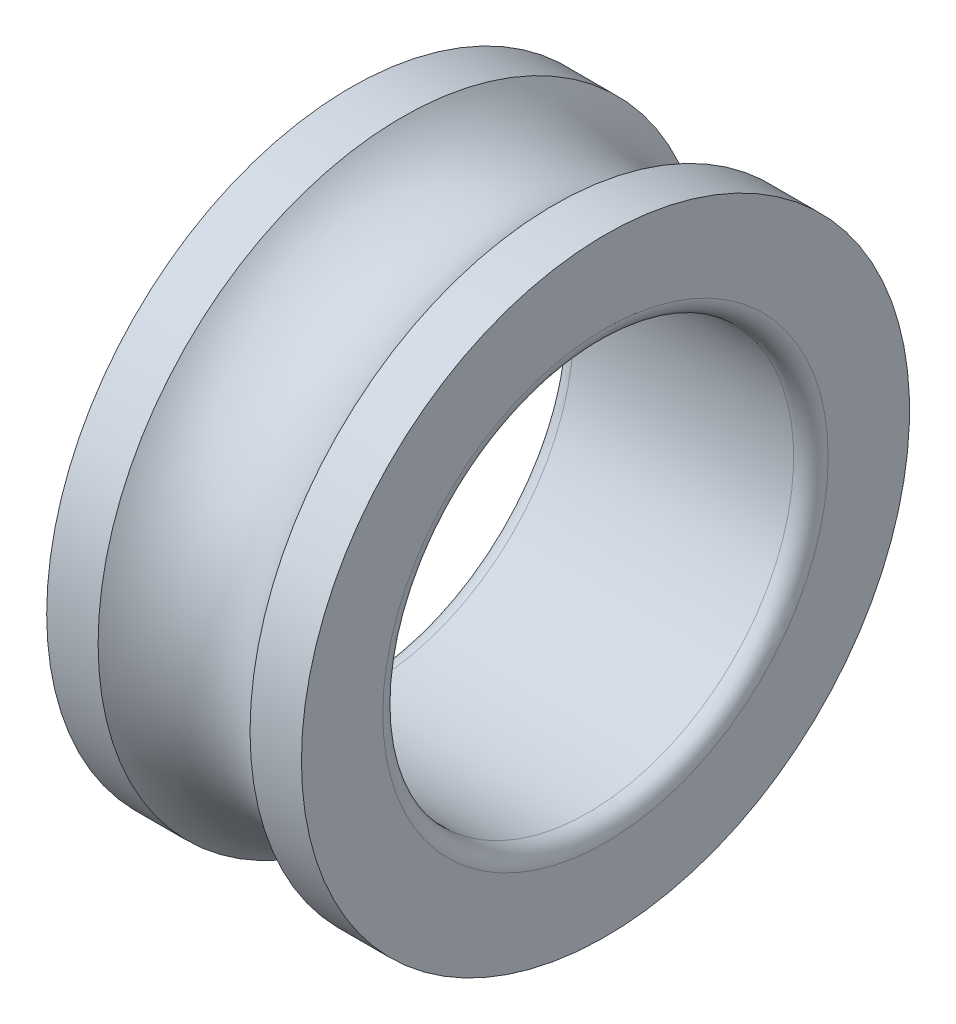
from build123d import *


with BuildPart() as part:
    # Sketch2 → Revolve1 (revolve)
    with BuildSketch(Plane.XY, mode=Mode.PRIVATE) as revolve1_sk:
        with BuildLine():
            Line((9.24426332, 37), (15.5, 37))
            Line((15.5, 37), (15.5, 27.1))
            ThreePointArc((15.5, 27.1), (14.88492424, 25.61507576), (13.4, 25))
            Line((13.4, 25), (-13.4, 25))
            ThreePointArc((-13.4, 25), (-14.88492424, 25.61507576), (-15.5, 27.1))
            Line((-15.5, 27.1), (-15.5, 37))
            Line((-15.5, 37), (-9.24426332, 37))
            ThreePointArc((-9.24426332, 37), (0, 32.651378677), (9.24426332, 37))
        make_face()
    revolve(revolve1_sk.sketch.rotate(Axis((-24.761443412, 0, 0), (1, 0, 0)), 90), axis=Axis((-24.761443412, 0, 0), (1, 0, 0)))


solid = part.part
